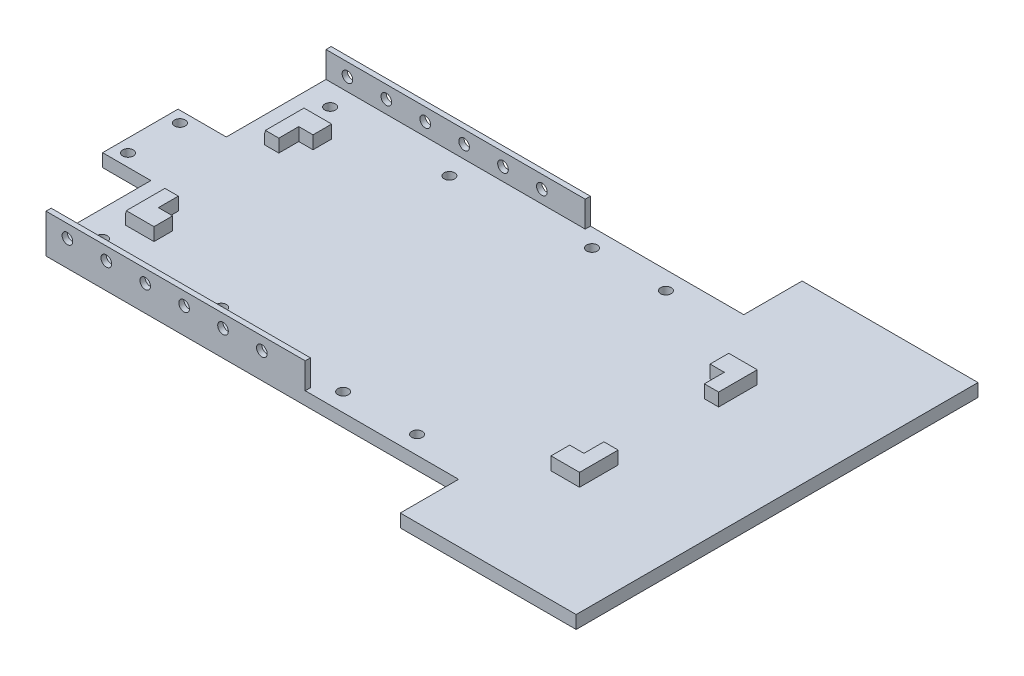
from build123d import *

# Parameters (mm, degrees)
SKETCH1_W           = 67
SKETCH1_H           = 155
SKETCH1_W_2         = 160
SKETCH1_H_2         = 110
SKETCH1_W_3         = 18.62
SKETCH1_H_3         = 29.1
BOSS_EXTRUDE1_DEPTH = 5
SKETCH4_W           = 100
SKETCH4_H           = 2
BOSS_EXTRUDE2_DEPTH = 10
SKETCH9_W           = 0.845761127
SKETCH9_H           = 22.5
BOSS_EXTRUDE4_DEPTH = 5
BOSS_EXTRUDE3_DEPTH = 5
SKETCH7_R           = 2.05
CUT_EXTRUDE2_DEPTH  = 10
SKETCH6_R           = 2.05
CUT_EXTRUDE1_DEPTH  = 227.055622359
SKETCH10_R          = 2.05
CUT_EXTRUDE4_DEPTH  = 10
FILLET1_R           = 0.3
SKETCH16_R          = 2.05
CUT_EXTRUDE5_DEPTH  = 251.551680098


with BuildPart() as part:
    # Sketch1 → Boss-Extrude1 (new body)
    with BuildSketch(Plane(origin=(0, 0, 0), x_dir=(1, 0, 0), z_dir=(0, 1, 0))):
        Rectangle(SKETCH1_W, SKETCH1_H)
        with Locations((-113.5, 0)):
            Rectangle(SKETCH1_W_2, SKETCH1_H_2)
        with Locations((-202.81, 0)):
            Rectangle(SKETCH1_W_3, SKETCH1_H_3)
    extrude(amount=BOSS_EXTRUDE1_DEPTH)

    # Sketch4 → Boss-Extrude2 (add)
    with BuildSketch(Plane(origin=(0, 5, 0), x_dir=(1, 0, 0), z_dir=(0, 1, 0))):
        with Locations((-143.5, -54)):
            Rectangle(SKETCH4_W, SKETCH4_H)
        with Locations((-143.5, 54)):
            Rectangle(SKETCH4_W, SKETCH4_H)
    extrude(amount=BOSS_EXTRUDE2_DEPTH)

    # Sketch9 → Boss-Extrude4 (add)
    with BuildSketch(Plane(origin=(0, 5, 0), x_dir=(1, 0, 0), z_dir=(0, 1, 0))):
        with Locations((-33.922880564, -66.25)):
            Rectangle(SKETCH9_W, SKETCH9_H)
        with Locations((-33.922880564, 66.25)):
            Rectangle(SKETCH9_W, SKETCH9_H)
    extrude(amount=-BOSS_EXTRUDE4_DEPTH)

    # Sketch5 → Boss-Extrude3 (add)
    with BuildSketch(Plane(origin=(0, 5, 0), x_dir=(1, 0, 0), z_dir=(0, 1, 0))):
        Polygon((-178, 27), (-172.5, 27), (-172.5, 34.2), (-183.5, 34.2), (-183.5, 19.3), (-178, 19.3), align=None)
        Polygon((-178, -27.15), (-172.5, -27.15), (-172.5, -34.35), (-183.5, -34.35), (-183.5, -19.45), (-178, -19.45), align=None)
        Polygon((-13.85, 27), (-13.85, 19.3), (-8.35, 19.3), (-8.35, 34.2), (-19.35, 34.2), (-19.35, 27), align=None)
        Polygon((-19.35, -27.15), (-19.35, -34.35), (-8.35, -34.35), (-8.35, -19.45), (-13.85, -19.45), (-13.85, -27.15), align=None)
    extrude(amount=BOSS_EXTRUDE3_DEPTH)

    # Sketch7 → Cut-Extrude2 (cut)
    with BuildSketch(Plane(origin=(0, 5, 0), x_dir=(1, 0, 0), z_dir=(0, 1, 0))):
        with Locations(Location((-207.12, 10.268043156, 0), (0, 0, 270))):
            Circle(SKETCH7_R)
        with Locations(Location((-207.12, -9.741956844, 0), (0, 0, 270))):
            Circle(SKETCH7_R)
    extrude(amount=-CUT_EXTRUDE2_DEPTH, mode=Mode.SUBTRACT)

    # Sketch6 → Cut-Extrude1 (cut, through all)
    with BuildSketch(Plane(origin=(0, 5, 0), x_dir=(1, 0, 0), z_dir=(0, 1, 0))):
        with Locations(Location((-85.880982052, -48, 0), (0, 0, 270))):
            Circle(SKETCH6_R)
        with Locations(Location((-57.380982052, -48, 0), (0, 0, 270))):
            Circle(SKETCH6_R)
        with Locations(Location((-57.380982052, 48, 0), (0, 0, 90))):
            Circle(SKETCH6_R)
        with Locations(Location((-85.880982052, 48, 0), (0, 0, 90))):
            Circle(SKETCH6_R)
    extrude(amount=-CUT_EXTRUDE1_DEPTH, mode=Mode.SUBTRACT)

    # Sketch10 → Cut-Extrude4 (cut)
    with BuildSketch(Plane(origin=(0, 5, 0), x_dir=(1, 0, 0), z_dir=(0, 1, 0))):
        with Locations(Location((-183.5, 44.599757133, 0), (0, 0, 270))):
            Circle(SKETCH10_R)
        with Locations(Location((-137.5, 44.599757133, 0), (0, 0, 270))):
            Circle(SKETCH10_R)
        with Locations(Location((-183.5, -43.400242867, 0), (0, 0, 270))):
            Circle(SKETCH10_R)
        with Locations(Location((-137.5, -43.400242867, 0), (0, 0, 270))):
            Circle(SKETCH10_R)
    extrude(amount=-CUT_EXTRUDE4_DEPTH, mode=Mode.SUBTRACT)

    # Fillet1
    fillet1_edges = [part.edges().sort_by_distance(p)[0] for p in [
        (-34.345761127, 2.5, 55),
        (-34.345761127, 2.5, -55),
    ]]
    fillet(fillet1_edges, radius=FILLET1_R)

    # Sketch16 → Cut-Extrude5 (cut, through all)
    with BuildSketch(Plane.XY.offset(55)):
        with Locations((-140.228178999, 10)):
            Circle(SKETCH16_R)
        with Locations((-125.228178999, 10)):
            Circle(SKETCH16_R)
        with Locations((-110.228178999, 10)):
            Circle(SKETCH16_R)
        with Locations((-155.228178999, 10)):
            Circle(SKETCH16_R)
        with Locations((-170.228178999, 10)):
            Circle(SKETCH16_R)
        with Locations((-185.228178999, 10)):
            Circle(SKETCH16_R)
    extrude(amount=-CUT_EXTRUDE5_DEPTH, mode=Mode.SUBTRACT)


solid = part.part
